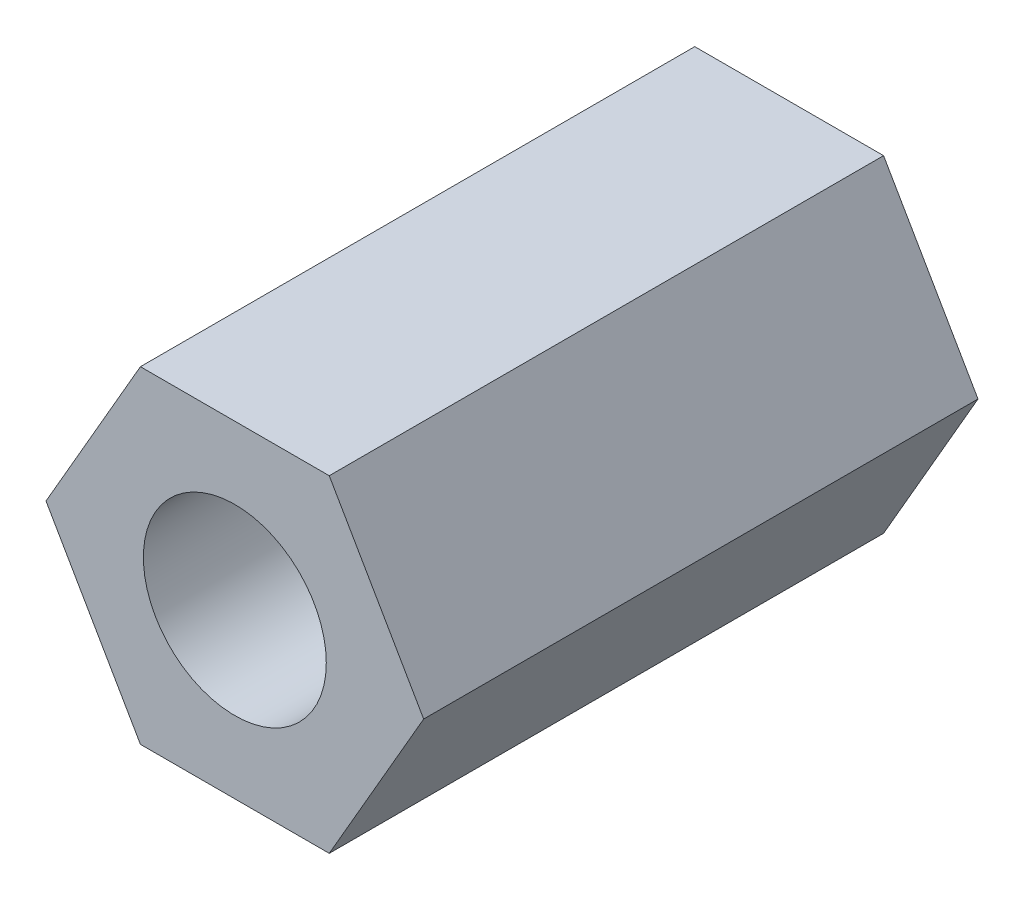
from build123d import *

# Parameters (mm, degrees)
EXTRUDE_1_DEPTH    = 10
HOLE_WIZARD_M4_1_D = 3.3


with BuildPart() as part:
    # 草图1 → 凸台-拉伸1 (new body)
    with BuildSketch(Plane.XY):
        Polygon((1.703183294, 2.95), (-1.703183294, 2.95), (-3.406366588, 0), (-1.703183294, -2.95), (1.703183294, -2.95), (3.406366588, 0), align=None)
    extrude(amount=EXTRUDE_1_DEPTH)

    # M4 螺纹孔1 (through all)
    with Locations(Plane.XY.offset(10)):
        with Locations((0, 0)):
            Hole(HOLE_WIZARD_M4_1_D / 2)


solid = part.part
